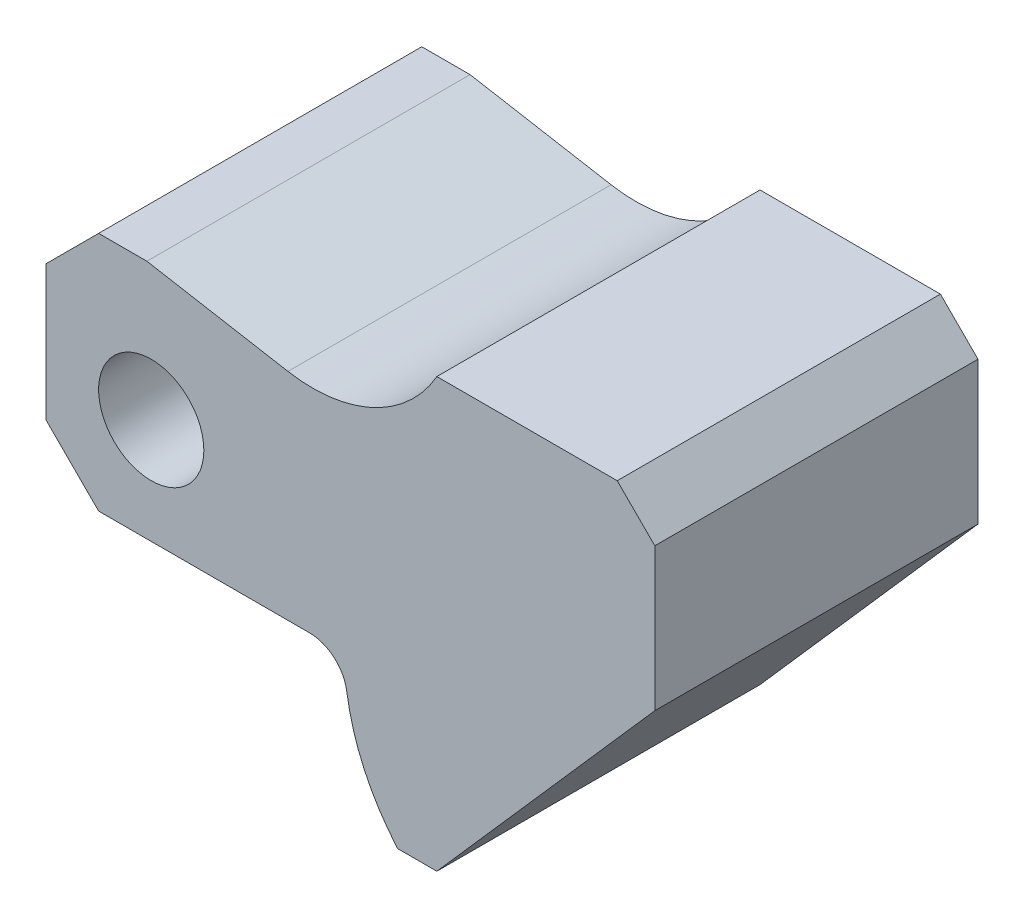
from build123d import *

# Parameters (mm, degrees)
SKETCH1_R           = 7
BOSS_EXTRUDE1_DEPTH = 43


with BuildPart() as part:
    # Sketch1 → Boss-Extrude1 (new body)
    with BuildSketch(Plane.XY):
        with BuildLine():
            Line((0, 0), (-7, 7))
            Line((-7, 7), (-7, 25))
            Line((-7, 25), (0, 32))
            Line((0, 32), (6.423127039, 32))
            Line((6.423127039, 32), (25.190133404, 28.690870431))
            ThreePointArc((25.190133404, 28.690870431), (36.570238436, 30.206263605), (45, 38))
            Line((45, 38), (69, 38))
            Line((69, 38), (74, 33))
            Line((74, 33), (74, 14))
            Line((74, 14), (45, -19))
            Line((45, -19), (39.788067397, -19))
            ThreePointArc((39.788067397, -19), (35.3490952, -12.115672061), (33.012264997, -4.264705882))
            ThreePointArc((33.012264997, -4.264705882), (31.331862036, -1.213413768), (28.066626255, 0))
            Line((28.066626255, 0), (0, 0))
        make_face()
        with Locations((7, 14)):
            Circle(SKETCH1_R, mode=Mode.SUBTRACT)
    extrude(amount=BOSS_EXTRUDE1_DEPTH)


solid = part.part
